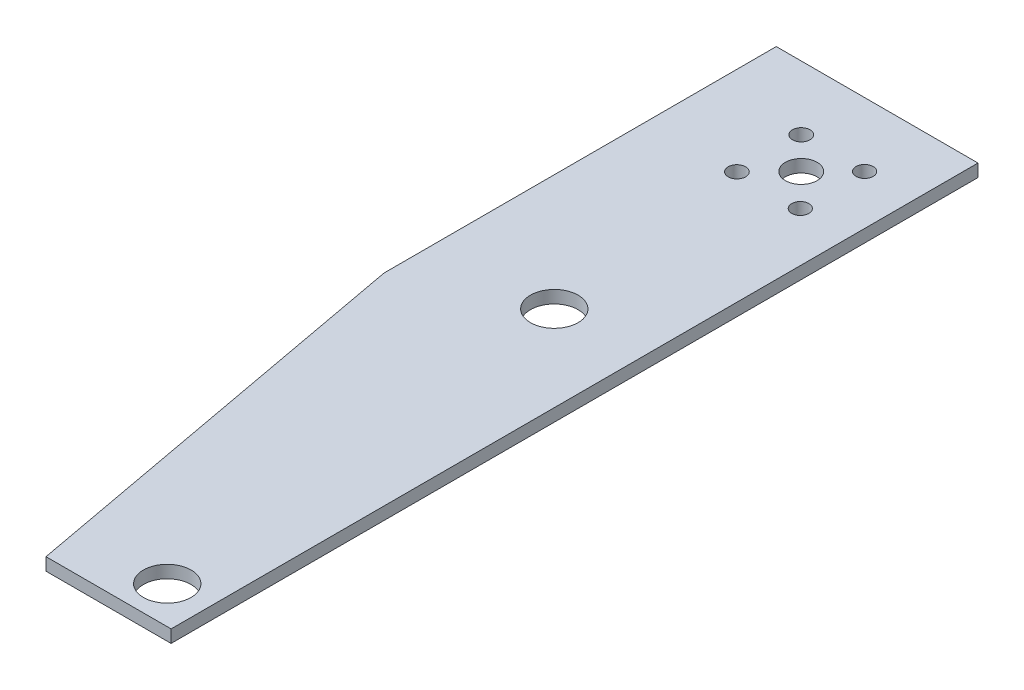
from build123d import *

# Parameters (mm, degrees)
SKETCH1_W           = 50.8
SKETCH1_H           = 203.2
BOSS_EXTRUDE1_DEPTH = 3.175
SKETCH2_R           = 2.2
SKETCH2_R_2         = 2.159579804
SKETCH2_R_3         = 4
CUT_EXTRUDE1_DEPTH  = 10
SKETCH5_R           = 6
CUT_EXTRUDE2_DEPTH  = 10
CUT_EXTRUDE3_DEPTH  = 10


with BuildPart() as part:
    # Sketch1 → Boss-Extrude1 (new body)
    with BuildSketch(Plane(origin=(0, 0, 0), x_dir=(1, 0, 0), z_dir=(0, 1, 0))):
        with Locations((25.4, 101.6)):
            Rectangle(SKETCH1_W, SKETCH1_H)
    extrude(amount=BOSS_EXTRUDE1_DEPTH)

    # Sketch2 → Cut-Extrude1 (cut)
    with BuildSketch(Plane(origin=(0, 3.175, 0), x_dir=(1, 0, 0), z_dir=(0, 1, 0))):
        with Locations(Location((22.384513462, 187.103195302, 0), (0, 0, 270))):
            Circle(SKETCH2_R)
        with Locations(Location((38.36448905, 187.082300612, 0), (0, 0, 270))):
            Circle(SKETCH2_R_2)
        with Locations(Location((22.363364113, 170.92846049, 0), (0, 0, 270))):
            Circle(SKETCH2_R)
        with Locations(Location((38.343339701, 170.907565799, 0), (0, 0, 270))):
            Circle(SKETCH2_R_2)
        with Locations(Location((30.385513462, 179.103195302, 0), (0, 0, 270))):
            Circle(SKETCH2_R_3)
    extrude(amount=-CUT_EXTRUDE1_DEPTH, mode=Mode.SUBTRACT)

    # Sketch5 → Cut-Extrude2 (cut)
    with BuildSketch(Plane(origin=(0, 0, 0), x_dir=(-1, 0, 0), z_dir=(0, -1, 0))):
        with Locations(Location((-40.462848215, 9.36892711, 0), (0, 0, 90))):
            Circle(SKETCH5_R)
        with Locations(Location((-29.259232092, 118.036539738, 0), (0, 0, 90))):
            Circle(SKETCH5_R)
    extrude(amount=-CUT_EXTRUDE2_DEPTH, mode=Mode.SUBTRACT)

    # Sketch6 → Cut-Extrude3 (cut)
    with BuildSketch(Plane(origin=(0, 3.175, 0), x_dir=(1, 0, 0), z_dir=(0, 1, 0))):
        Polygon((0, 0), (19.29895822, 0), (-0.185019924, 105.431539045), align=None)
    extrude(amount=-CUT_EXTRUDE3_DEPTH, mode=Mode.SUBTRACT)


solid = part.part
